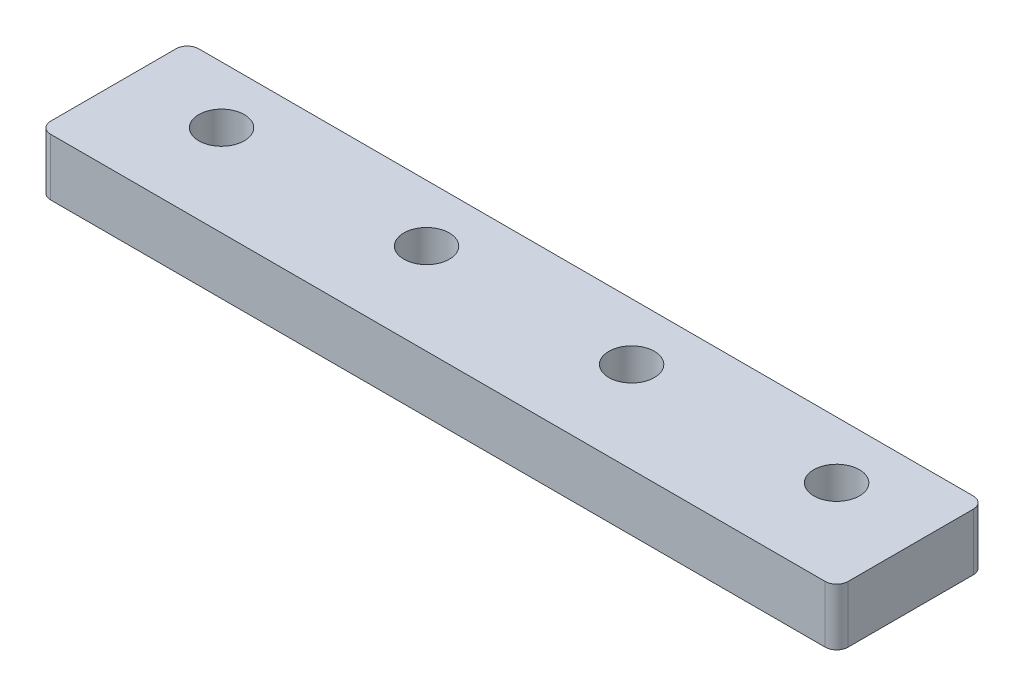
from build123d import *

# Parameters (mm, degrees)
SKETCH_1_R      = 2
EXTRUDE_1_DEPTH = 5
FILLET_1_R      = 1


with BuildPart() as part:
    # 草图1 → 凸台-拉伸1 (new body)
    with BuildSketch(Plane(origin=(0, 0, 0), x_dir=(1, 0, 0), z_dir=(0, 1, 0))):
        Polygon((-35, 5), (35, 5), (35, -5), (35, -8), (-35, -8), (-35, -5), align=None)
        with Locations(Location((-27, 0, 0), (0, 0, 270))):
            Circle(SKETCH_1_R, mode=Mode.SUBTRACT)
        with Locations(Location((-9, 0, 0), (0, 0, 270))):
            Circle(SKETCH_1_R, mode=Mode.SUBTRACT)
        with Locations(Location((9, 0, 0), (0, 0, 90))):
            Circle(SKETCH_1_R, mode=Mode.SUBTRACT)
        with Locations(Location((27, 0, 0), (0, 0, 90))):
            Circle(SKETCH_1_R, mode=Mode.SUBTRACT)
    extrude(amount=EXTRUDE_1_DEPTH)

    # 圆角1
    fillet_1_edges = [part.edges().sort_by_distance(p)[0] for p in [
        (35, 2.5, 8),
        (-35, 2.5, 8),
        (-35, 2.5, -5),
        (35, 2.5, -5),
    ]]
    fillet(fillet_1_edges, radius=FILLET_1_R)


solid = part.part
